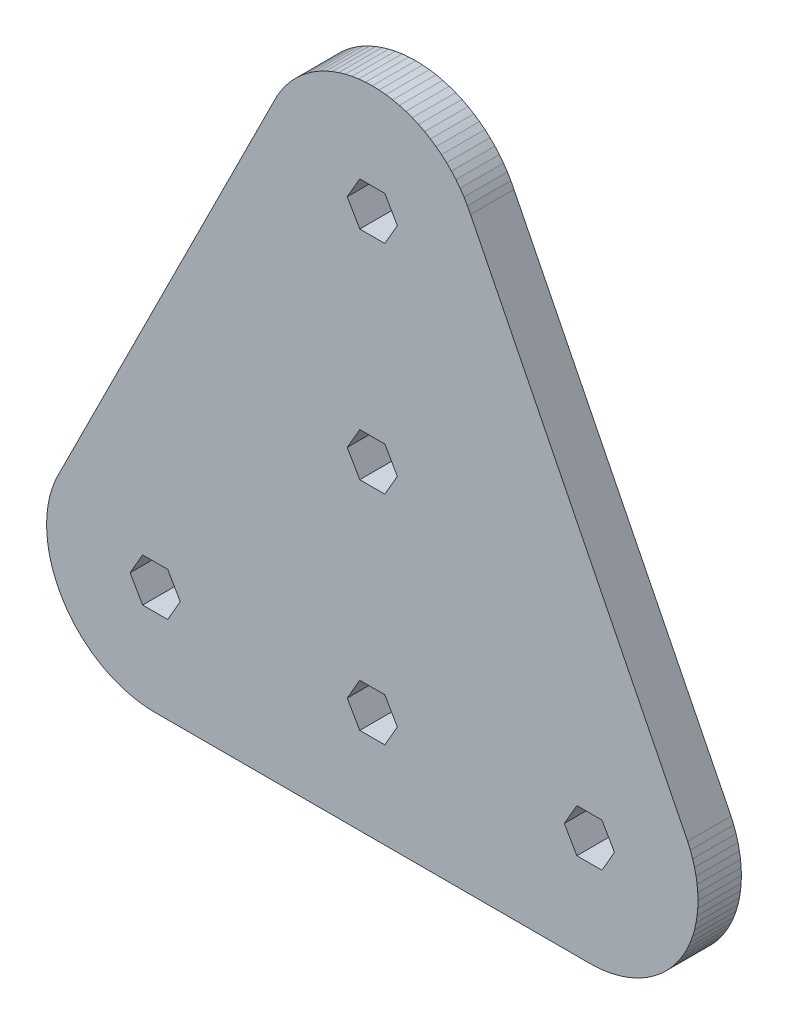
from build123d import *

# Parameters (mm, degrees)
BOSS_EXTRUDE1_DEPTH = 3


with BuildPart() as part:
    # Sketch1 → Boss-Extrude1 (new body)
    with BuildSketch(Plane.XY.offset(3)):
        Polygon((22.3672, -1.40536), (22.4409, -0.939999), (22.4852, -0.470929), (22.5, 0), (22.4852, 0.470929), (22.4409, 0.939999), (22.3672, 1.40536), (22.2644, 1.86517), (22.1329, 2.31763), (21.9733, 2.76093), (21.7862, 3.19334), (6.7862, 33.1933), (6.5723, 33.6132), (6.33246, 34.0187), (6.06763, 34.4084), (5.77885, 34.7807), (5.46726, 35.1341), (5.1341, 35.4673), (4.78068, 35.7788), (4.40839, 36.0676), (4.0187, 36.3325), (3.61315, 36.5723), (3.19334, 36.7862), (2.76093, 36.9733), (2.31763, 37.1329), (1.86517, 37.2644), (1.40536, 37.3672), (0.939999, 37.4409), (0.470929, 37.4852), (0, 37.5), (-0.470929, 37.4852), (-0.939999, 37.4409), (-1.40536, 37.3672), (-1.86517, 37.2644), (-2.31763, 37.1329), (-2.76093, 36.9733), (-3.19334, 36.7862), (-3.61315, 36.5723), (-4.0187, 36.3325), (-4.40839, 36.0676), (-4.78068, 35.7788), (-5.1341, 35.4673), (-5.46726, 35.1341), (-5.77885, 34.7807), (-6.06763, 34.4084), (-6.33246, 34.0187), (-6.5723, 33.6132), (-6.7862, 33.1933), (-21.7862, 3.19334), (-21.9733, 2.76093), (-22.1329, 2.31763), (-22.2644, 1.86517), (-22.3672, 1.40536), (-22.4409, 0.939999), (-22.4852, 0.470929), (-22.5, 0), (-22.4852, -0.470929), (-22.4409, -0.939999), (-22.3672, -1.40536), (-22.2644, -1.86517), (-22.1329, -2.31763), (-21.9733, -2.76093), (-21.7862, -3.19334), (-21.5723, -3.61315), (-21.3325, -4.0187), (-21.0676, -4.40839), (-20.7788, -4.78068), (-20.4673, -5.1341), (-20.1341, -5.46726), (-19.7807, -5.77885), (-19.4084, -6.06763), (-19.0187, -6.33246), (-18.6132, -6.5723), (-18.1933, -6.7862), (-17.7609, -6.97332), (-17.3176, -7.13292), (-16.8652, -7.26437), (-16.4054, -7.36715), (-15.94, -7.44086), (-15.4709, -7.4852), (-15, -7.5), (15, -7.5), (15.4709, -7.4852), (15.94, -7.44086), (16.4054, -7.36715), (16.8652, -7.26437), (17.3176, -7.13292), (17.7609, -6.97332), (18.1933, -6.7862), (18.6132, -6.5723), (19.0187, -6.33246), (19.4084, -6.06763), (19.7807, -5.77885), (20.1341, -5.46726), (20.4673, -5.1341), (20.7788, -4.78068), (21.0676, -4.40839), (21.3325, -4.0187), (21.5723, -3.61315), (21.7862, -3.19334), (21.9733, -2.76093), (22.1329, -2.31763), (22.2644, -1.86517), align=None)
        Polygon((0.866025, 1.5), (1.73205, 0), (0.866025, -1.5), (-0.866025, -1.5), (-1.73205, 0), (-0.866025, 1.5), align=None, mode=Mode.SUBTRACT)
        Polygon((-0.866025, 31.5), (0.866025, 31.5), (1.73205, 30), (0.866025, 28.5), (-0.866025, 28.5), (-1.73205, 30), align=None, mode=Mode.SUBTRACT)
        Polygon((15.866, 1.5), (16.7321, 0), (15.866, -1.5), (14.134, -1.5), (13.2679, 0), (14.134, 1.5), align=None, mode=Mode.SUBTRACT)
        Polygon((0.866025, 16.5), (1.73205, 15), (0.866025, 13.5), (-0.866025, 13.5), (-1.73205, 15), (-0.866025, 16.5), align=None, mode=Mode.SUBTRACT)
        Polygon((-14.134, 1.5), (-13.2679, 0), (-14.134, -1.5), (-15.866, -1.5), (-16.7321, 0), (-15.866, 1.5), align=None, mode=Mode.SUBTRACT)
    extrude(amount=-BOSS_EXTRUDE1_DEPTH)


solid = part.part
